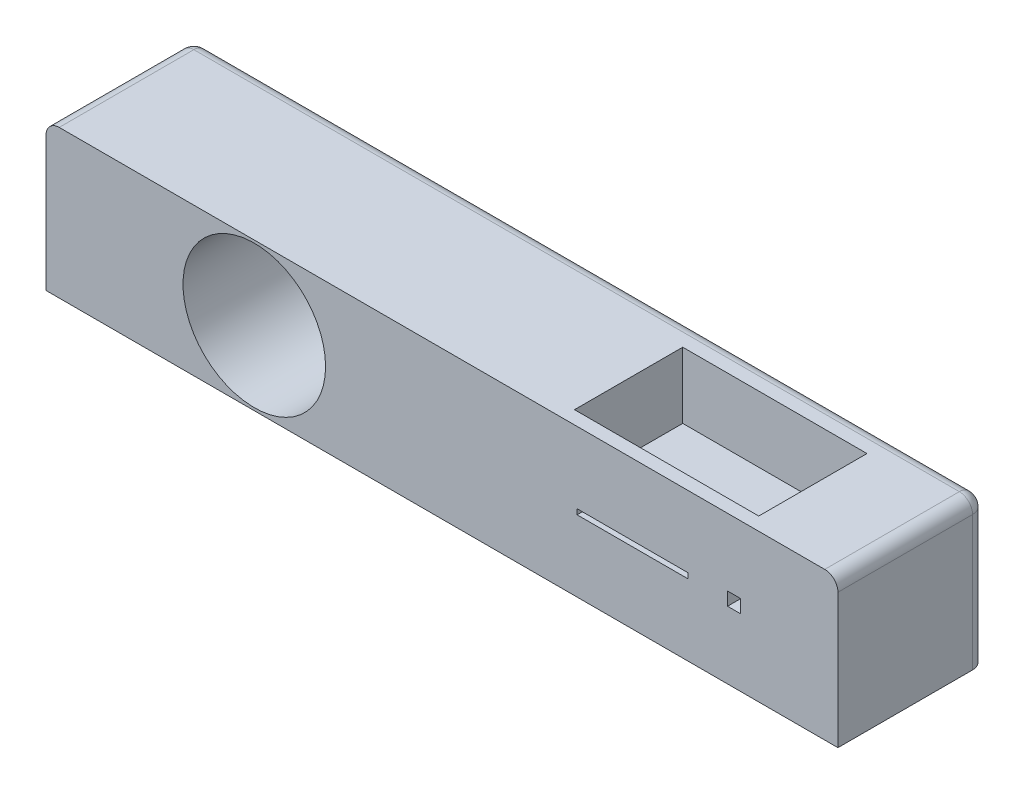
from build123d import *

# Parameters (mm, degrees)
SKETCH1_W           = 300
SKETCH1_H           = 56
BOSS_EXTRUDE1_DEPTH = 56
FILLET1_R           = 5
SKETCH2_R           = 27
SKETCH2_W           = 42
SKETCH2_H           = 2
SKETCH2_W_2         = 5
SKETCH2_H_2         = 5
CUT_EXTRUDE1_DEPTH  = 50
SKETCH3_W           = 69.790407192
SKETCH3_H           = 41
CUT_EXTRUDE2_DEPTH  = 25


with BuildPart() as part:
    # Sketch1 → Boss-Extrude1 (new body)
    with BuildSketch(Plane.XY):
        Rectangle(SKETCH1_W, SKETCH1_H)
    extrude(amount=BOSS_EXTRUDE1_DEPTH)

    # Fillet1
    fillet1_edges = [part.edges().sort_by_distance(p)[0] for p in [
        (-150, 0, 0),
        (0, 28, 0),
        (150, 0, 0),
        (-150, 28, 28),
        (150, 28, 28),
    ]]
    fillet(fillet1_edges, radius=FILLET1_R)

    # Sketch2 → Cut-Extrude1 (cut)
    with BuildSketch(Plane.XY.offset(56)):
        with Locations((-71.095356244, 0)):
            Circle(SKETCH2_R)
        with Locations((72.182261243, 0)):
            Rectangle(SKETCH2_W, SKETCH2_H)
        with Locations((110.682261243, 0)):
            Rectangle(SKETCH2_W_2, SKETCH2_H_2)
    extrude(amount=-CUT_EXTRUDE1_DEPTH, mode=Mode.SUBTRACT)

    # Sketch3 → Cut-Extrude2 (cut)
    with BuildSketch(Plane(origin=(0, 28, 0), x_dir=(1, 0, 0), z_dir=(0, 1, 0))):
        with Locations((80.104796404, -30.5)):
            Rectangle(SKETCH3_W, SKETCH3_H)
    extrude(amount=-CUT_EXTRUDE2_DEPTH, mode=Mode.SUBTRACT)


solid = part.part
